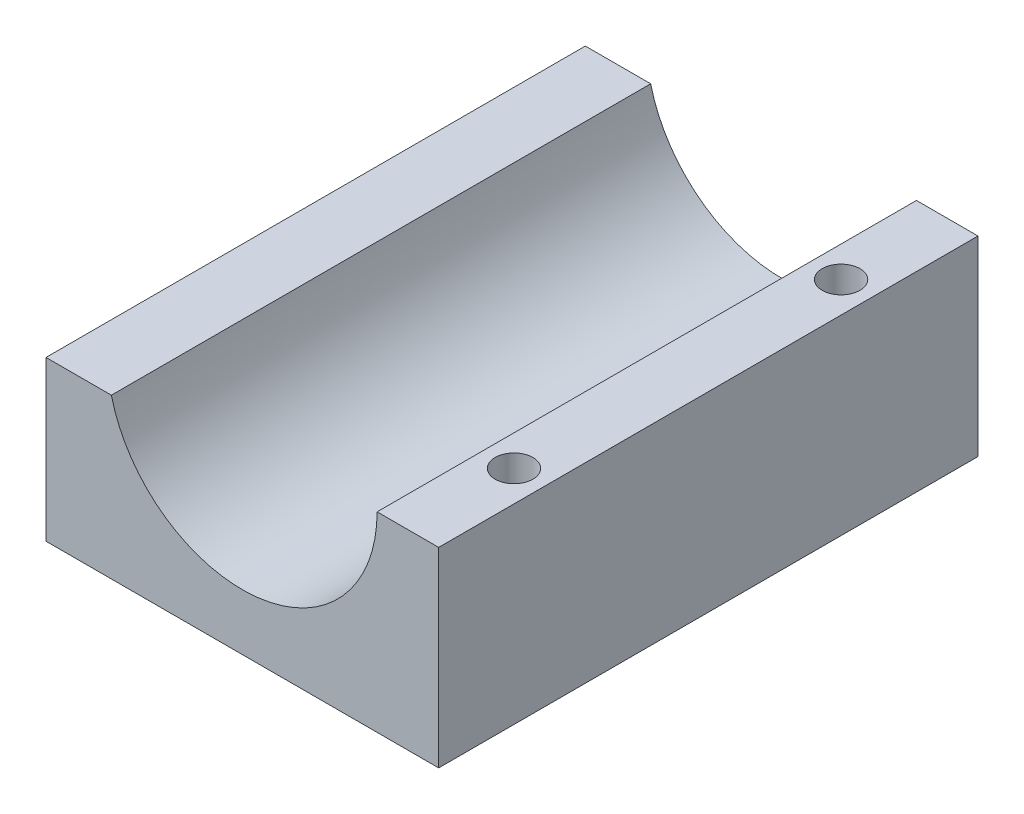
from build123d import *

# Parameters (mm, degrees)
SKETCH2_W                 = 18.5
SKETCH2_H                 = 25.41
BOSS_EXTRUDE1_DEPTH       = 9
CUT_EXTRUDE1_DEPTH        = 25.41
F_2_56_TAPPED_HOLE1_D     = 1.778
F_2_56_TAPPED_HOLE1_DEPTH = 1.96583491
F_2_56_TAPPED_HOLE1_TIP   = 0.53416509
F_2_56_TAPPED_HOLE2_D     = 1.778
F_2_56_TAPPED_HOLE2_DEPTH = 3.46583491
F_2_56_TAPPED_HOLE2_TIP   = 0.53416509
CUT_EXTRUDE3_DEPTH        = 33.694312961
CUT_EXTRUDE3_DEPTH_BACK   = 25.41


with BuildPart() as part:
    # Sketch2 → Boss-Extrude1 (new body)
    with BuildSketch(Plane(origin=(0, 0, 0), x_dir=(1, 0, 0), z_dir=(0, 1, 0))):
        with Locations((9.25, 12.705)):
            Rectangle(SKETCH2_W, SKETCH2_H)
    extrude(amount=BOSS_EXTRUDE1_DEPTH)

    # Sketch6 → Cut-Extrude1 (cut)
    with BuildSketch(Plane.XY):
        with BuildLine():
            Line((2.9, 9), (15.6, 9))
            ThreePointArc((15.6, 9), (9.25, 2.65), (2.9, 9))
        make_face()
    extrude(amount=-CUT_EXTRUDE1_DEPTH, mode=Mode.SUBTRACT)

    # #2-56 Tapped Hole1
    with Locations(Plane(origin=(0, 0, 0), x_dir=(-1, 0, 0), z_dir=(0, -1, 0))):
        with Locations((-9.25, 20.41), (-9.25, 5)):
            Hole(F_2_56_TAPPED_HOLE1_D / 2, depth=F_2_56_TAPPED_HOLE1_DEPTH)
            with Locations((0, 0, -(F_2_56_TAPPED_HOLE1_DEPTH + F_2_56_TAPPED_HOLE1_TIP / 2))):  # 118° drill point
                Cone(0, F_2_56_TAPPED_HOLE1_D / 2, F_2_56_TAPPED_HOLE1_TIP, mode=Mode.SUBTRACT)

    # #2-56 Tapped Hole2
    with Locations(Plane(origin=(0, 9, 0), x_dir=(1, 0, 0), z_dir=(0, 1, 0))):
        with Locations((17.05, 20.41), (17.05, 5)):
            Hole(F_2_56_TAPPED_HOLE2_D / 2, depth=F_2_56_TAPPED_HOLE2_DEPTH)
            with Locations((0, 0, -(F_2_56_TAPPED_HOLE2_DEPTH + F_2_56_TAPPED_HOLE2_TIP / 2))):  # 118° drill point
                Cone(0, F_2_56_TAPPED_HOLE2_D / 2, F_2_56_TAPPED_HOLE2_TIP, mode=Mode.SUBTRACT)

    # Sketch14 → Cut-Extrude3 (cut, two sides: drawn at the far end of the back side and taken through both)
    with BuildSketch(Plane(origin=(0, 0, -25.41), x_dir=(-1, 0, 0), z_dir=(0, 0, -1)).offset(-CUT_EXTRUDE3_DEPTH_BACK)):
        Polygon((0, 60.146081223), (0, 9), (0, 7.5), (-3.246658661, 7.5), (-2.9, 9), (8.616604878, 58.832614185), (24.031387378, 159.956651774), (15.4147825, 161.270118812), align=None)
    extrude(amount=CUT_EXTRUDE3_DEPTH + CUT_EXTRUDE3_DEPTH_BACK, mode=Mode.SUBTRACT)


with BuildPart() as cut_extrude3_kept_piece:
    # of the separate pieces the step leaves, the one the design keeps (cut_extrude3_pieces_kept)
    add(part.part.solids().sort_by_distance((0, 0, 0))[0])


solid = cut_extrude3_kept_piece.part
